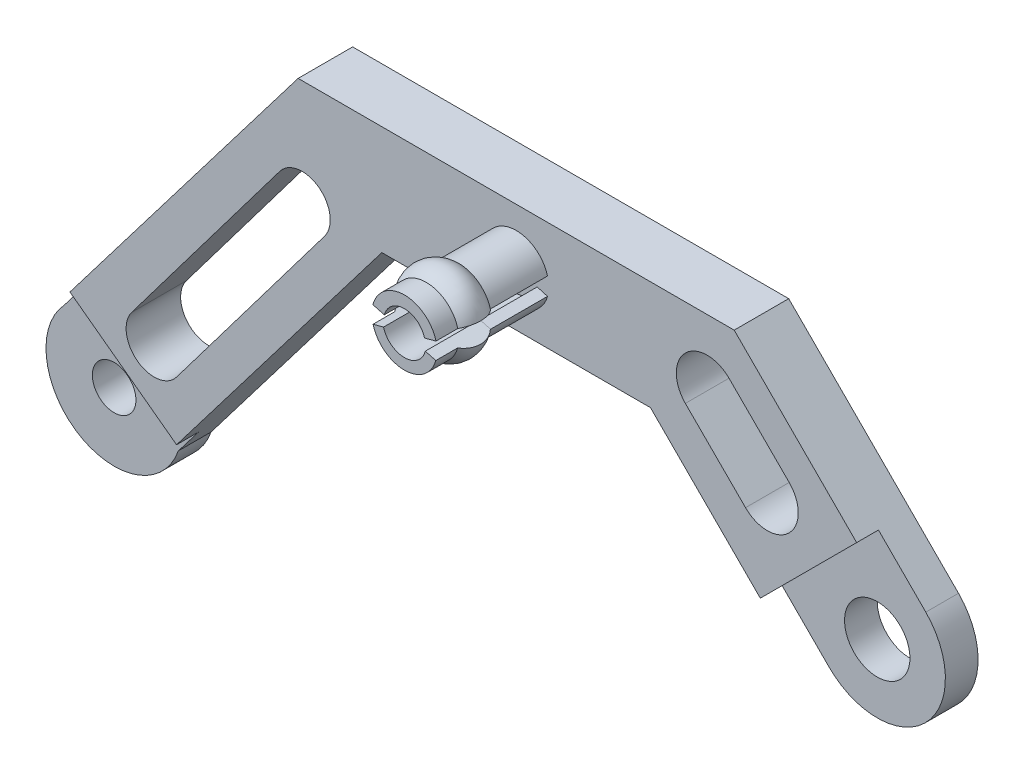
from build123d import *

# Parameters (mm, degrees)
SZKIC1_R                    = 2
SZKIC1_R_2                  = 3
DODANIE_WYCI_GNI_CIE1_DEPTH = 5
WYTNIJ_WYCI_GNI_CIE2_DEPTH  = 10
WYTNIJ_WYCI_GNI_CIE4_DEPTH  = 10
DODANIE_WYCI_GNI_CIE2_DEPTH = 5.25
OBR_T1_ANGLE                = 75
OBR_T1_OTHER_WAY_ANGLE      = 75
OBR_T2_ANGLE                = 75
OBR_T2_OTHER_WAY_ANGLE      = 75
WYTNIJ_WYCI_GNI_CIE5_DEPTH  = 2


with BuildPart() as part:
    # Szkic1 → Dodanie-wyciągnięcie1 (new body)
    with BuildSketch(Plane.XY):
        with BuildLine():
            Line((-20, 0), (20, 0))
            Line((20, 0), (35.574751144, -15.6155831))
            ThreePointArc((35.574751144, -15.6155831), (35.476976606, -24.481579544), (26.61176868, -24.328148016))
            Line((26.61176868, -24.328148016), (12.321086207, -10))
            Line((12.321086207, -10), (-12.321086207, -10))
            Line((-12.321086207, -10), (-32.989436275, -37.090675759))
            ThreePointArc((-32.989436275, -37.090675759), (-42.12272692, -40.342590816), (-43.451924108, -30.739196396))
            Line((-43.451924108, -30.739196396), (-20, 0))
        make_face()
        with Locations((-38.879391697, -35)):
            Circle(SZKIC1_R, mode=Mode.SUBTRACT)
        with Locations((31.120608303, -20)):
            Circle(SZKIC1_R_2, mode=Mode.SUBTRACT)
    extrude(amount=DODANIE_WYCI_GNI_CIE1_DEPTH)

    # Szkic3 → Wytnij-wyciągnięcie2 (cut)
    with BuildSketch(Plane(origin=(0, 0, 0), x_dir=(-1, 0, 0), z_dir=(0, 0, -1))):
        with BuildLine():
            Line((21.683047095, -8.225427037), (35.260679995, -26.209046772))
            ThreePointArc((35.260679995, -26.209046772), (34.75757763, -29.812902485), (31.153721917, -29.309800121))
            Line((31.153721917, -29.309800121), (17.576089017, -11.326180386))
            ThreePointArc((17.576089017, -11.326180386), (18.079191382, -7.722324673), (21.683047095, -8.225427037))
        make_face()
    extrude(amount=-WYTNIJ_WYCI_GNI_CIE2_DEPTH, mode=Mode.SUBTRACT)

    # Szkic4 → Wytnij-wyciągnięcie4 (cut)
    with BuildSketch(Plane(origin=(0, 0, 0), x_dir=(-1, 0, 0), z_dir=(0, 0, -1))):
        with BuildLine():
            Line((-15.517695436, -8.06176207), (-21.039997823, -13.584064457))
            ThreePointArc((-21.039997823, -13.584064457), (-25.043667053, -13.584064457), (-25.043667053, -9.580395227))
            Line((-25.043667053, -9.580395227), (-19.521364667, -4.05809284))
            ThreePointArc((-19.521364667, -4.05809284), (-15.517695436, -4.05809284), (-15.517695436, -8.06176207))
        make_face()
    extrude(amount=-WYTNIJ_WYCI_GNI_CIE4_DEPTH, mode=Mode.SUBTRACT)

    # Szkic5 → Dodanie-wyciągnięcie2 (add)
    with BuildSketch(Plane.XY.offset(5)):
        with BuildLine():
            Line((-1.922496946, -4.528242282), (-2.878604971, -4.259692233))
            ThreePointArc((-2.878604971, -4.259692233), (0, -2.078230062), (2.878604971, -4.259692233))
            Line((2.878604971, -4.259692233), (1.925488275, -4.527402083))
            ThreePointArc((1.925488275, -4.527402083), (0.001178609, -3.075757991), (-1.922496946, -4.528242282))
        make_face()
        with BuildLine():
            Line((-1.925488275, -5.609058042), (-2.878604971, -5.876767892))
            ThreePointArc((-2.878604971, -5.876767892), (0, -8.058230062), (2.878604971, -5.876767892))
            Line((2.878604971, -5.876767892), (1.925488275, -5.609058042))
            ThreePointArc((1.925488275, -5.609058042), (0, -7.068230062), (-1.925488275, -5.609058042))
        make_face()
    extrude(amount=DODANIE_WYCI_GNI_CIE2_DEPTH)

    # Szkic6 → Obrót1 (revolve)
    with BuildSketch(Plane(origin=(0, 0, 0), x_dir=(0, 0, -1), z_dir=(1, 0, 0))):
        with BuildLine():
            Line((-10.25, -2.078230062), (-10.25, -3.168961147))
            Line((-10.25, -3.168961147), (-13.25, -3.168961147))
            Line((-13.25, -3.168961147), (-15.25, -3.168961147))
            Line((-15.25, -3.168961147), (-15.25, -2.078230062))
            Line((-15.25, -2.078230062), (-13.25, -2.078230062))
            ThreePointArc((-13.25, -2.078230062), (-11.75, -1.456909719), (-10.25, -2.078230062))
        make_face()
    revolve(axis=Axis((0, -5.076440198, 10.25), (0, 0, 1)), revolution_arc=OBR_T1_ANGLE)

    # Szkic6 → Obrót1 other way (revolve)
    with BuildSketch(Plane(origin=(0, 0, 0), x_dir=(0, 0, -1), z_dir=(1, 0, 0))):
        with BuildLine():
            Line((-10.25, -2.078230062), (-10.25, -3.168961147))
            Line((-10.25, -3.168961147), (-13.25, -3.168961147))
            Line((-13.25, -3.168961147), (-15.25, -3.168961147))
            Line((-15.25, -3.168961147), (-15.25, -2.078230062))
            Line((-15.25, -2.078230062), (-13.25, -2.078230062))
            ThreePointArc((-13.25, -2.078230062), (-11.75, -1.456909719), (-10.25, -2.078230062))
        make_face()
    revolve(axis=Axis((0, -5.076440198, 10.25), (0, 0, -1)), revolution_arc=OBR_T1_OTHER_WAY_ANGLE)

    # Szkic7 → Obrót2 (revolve)
    with BuildSketch(Plane(origin=(0, 0, 0), x_dir=(0, 0, -1), z_dir=(1, 0, 0))):
        with BuildLine():
            Line((-10.25, -8.058230062), (-10.25, -7.058230062))
            Line((-10.25, -7.058230062), (-13.25, -7.058230062))
            Line((-13.25, -7.058230062), (-15.25, -7.058230062))
            Line((-15.25, -7.058230062), (-15.25, -8.058230062))
            Line((-15.25, -8.058230062), (-13.25, -8.058230062))
            ThreePointArc((-13.25, -8.058230062), (-11.75, -8.679550406), (-10.25, -8.058230062))
        make_face()
    revolve(axis=Axis((0, -5.076440198, 10.25), (0, 0, 1)), revolution_arc=OBR_T2_ANGLE)

    # Szkic7 → Obrót2 other way (revolve)
    with BuildSketch(Plane(origin=(0, 0, 0), x_dir=(0, 0, -1), z_dir=(1, 0, 0))):
        with BuildLine():
            Line((-10.25, -8.058230062), (-10.25, -7.058230062))
            Line((-10.25, -7.058230062), (-13.25, -7.058230062))
            Line((-13.25, -7.058230062), (-15.25, -7.058230062))
            Line((-15.25, -7.058230062), (-15.25, -8.058230062))
            Line((-15.25, -8.058230062), (-13.25, -8.058230062))
            ThreePointArc((-13.25, -8.058230062), (-11.75, -8.679550406), (-10.25, -8.058230062))
        make_face()
    revolve(axis=Axis((0, -5.076440198, 10.25), (0, 0, -1)), revolution_arc=OBR_T2_OTHER_WAY_ANGLE)

    # Szkic8 → Wytnij-wyciągnięcie5 (cut)
    with BuildSketch(Plane.XY.offset(5)):
        Polygon((32.418877384, -10.075958781), (21.264768771, -21.230067395), (33.267088147, -33.232386771), (44.42119676, -22.078278157), align=None)
        Polygon((-43.105497635, -25.826079918), (-28.078060253, -36.957515017), (-36.726120492, -48.63239634), (-51.753557875, -37.500961242), align=None)
    extrude(amount=-WYTNIJ_WYCI_GNI_CIE5_DEPTH, mode=Mode.SUBTRACT)


solid = part.part
